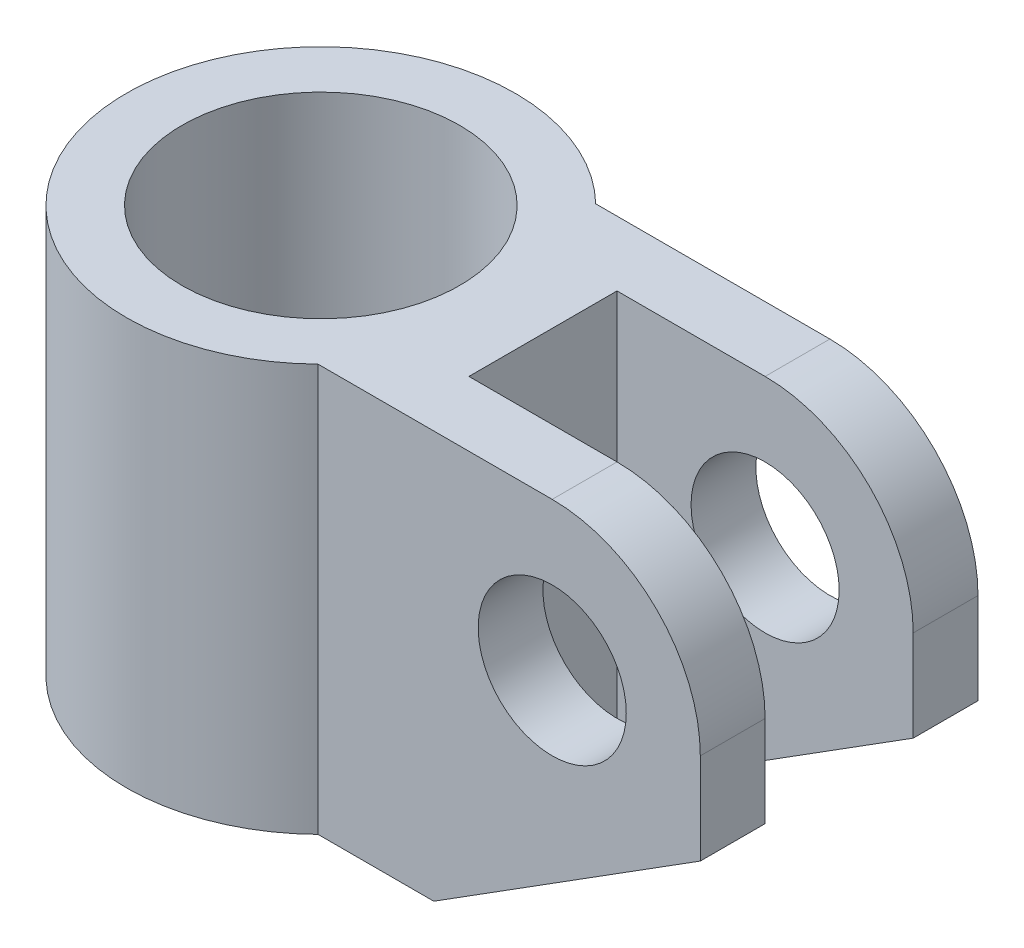
from build123d import *

# Parameters (mm, degrees)
SKETCH1_R           = 7.5
BOSS_EXTRUDE1_DEPTH = 22
CUT_EXTRUDE1_REACH  = 41.9
SKETCH2_R           = 4


with BuildPart() as part:
    # Sketch1 → Boss-Extrude1 (new body)
    with BuildSketch(Plane(origin=(0, 0, 0), x_dir=(1, 0, 0), z_dir=(0, 1, 0))):
        with BuildLine():
            Line((28, 7.5), (7.348469228, 7.5))
            ThreePointArc((7.348469228, 7.5), (-10.5, 0), (7.348469228, -7.5))
            Line((7.348469228, -7.5), (28, -7.5))
            Line((28, -7.5), (28, -4))
            Line((28, -4), (12, -4))
            Line((12, -4), (12, 4))
            Line((12, 4), (28, 4))
            Line((28, 4), (28, 7.5))
        make_face()
        with Locations(Location((0, 0, 0), (0, 0, 270))):
            Circle(SKETCH1_R, mode=Mode.SUBTRACT)
    extrude(amount=BOSS_EXTRUDE1_DEPTH)

    # Cut-Extrude1: up to this face of the body (flat: up to its plane)
    cut_extrude1_end = Plane(part.part.faces().sort_by_distance((17.674234614, 11, -7.5))[0])
    # Sketch2 → Cut-Extrude1 (cut, up to the picked face)
    with BuildSketch(Plane.XY.offset(7.5), mode=Mode.PRIVATE) as cut_extrude1_sk1:
        with Locations((20, 14)):
            Circle(SKETCH2_R)
    cut_extrude1_tool1 = split(extrude(cut_extrude1_sk1.sketch, amount=-CUT_EXTRUDE1_REACH, mode=Mode.PRIVATE), bisect_by=cut_extrude1_end, keep=Keep.BOTH, mode=Mode.PRIVATE)
    # Sketch2 → Cut-Extrude1 (cut, up to the picked face)
    with BuildSketch(Plane.XY.offset(7.5), mode=Mode.PRIVATE) as cut_extrude1_sk2:
        Polygon((28, 9.077491087), (13.602007738, 0), (28, 0), align=None)
    cut_extrude1_tool2 = split(extrude(cut_extrude1_sk2.sketch, amount=-CUT_EXTRUDE1_REACH, mode=Mode.PRIVATE), bisect_by=cut_extrude1_end, keep=Keep.BOTH, mode=Mode.PRIVATE)
    # Sketch2 → Cut-Extrude1 (cut, up to the picked face)
    with BuildSketch(Plane.XY.offset(7.5), mode=Mode.PRIVATE) as cut_extrude1_sk3:
        with BuildLine():
            Line((20, 22), (20, 25.764527095))
            Line((20, 25.764527095), (29.423240249, 25.764527095))
            Line((29.423240249, 25.764527095), (29.423240249, 14))
            Line((29.423240249, 14), (28, 14))
            ThreePointArc((28, 14), (25.656854249, 19.656854249), (20, 22))
        make_face()
    cut_extrude1_tool3 = split(extrude(cut_extrude1_sk3.sketch, amount=-CUT_EXTRUDE1_REACH, mode=Mode.PRIVATE), bisect_by=cut_extrude1_end, keep=Keep.BOTH, mode=Mode.PRIVATE)
    add(cut_extrude1_tool1.solids().sort_by(Axis((20, 14, 7.5), (0, 0, -1)))[0], mode=Mode.SUBTRACT)
    add(cut_extrude1_tool2.solids().sort_by(Axis((23.200669, 3.02583, 7.5), (0, 0, -1)))[0], mode=Mode.SUBTRACT)
    add(cut_extrude1_tool3.solids().sort_by(Axis((25.803554, 21.945292, 7.5), (0, 0, -1)))[0], mode=Mode.SUBTRACT)


solid = part.part
